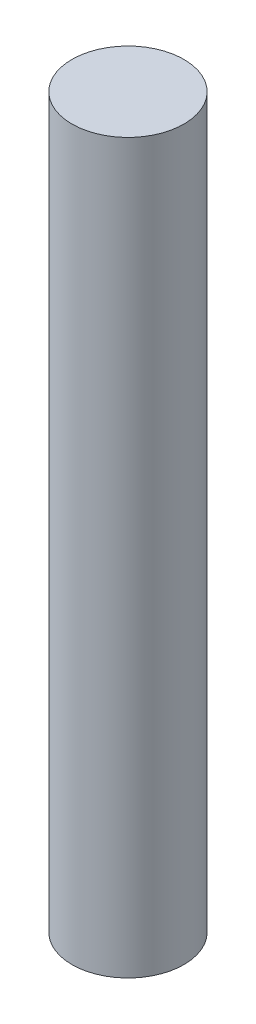
from build123d import *

# Parameters (mm, degrees)
SKETCH1_R           = 5
BOSS_EXTRUDE1_DEPTH = 32.5


with BuildPart() as part:
    # Sketch1 → Boss-Extrude1 (new, symmetric)
    with BuildSketch(Plane(origin=(0, 0, 0), x_dir=(1, 0, 0), z_dir=(0, 1, 0))):
        with Locations(Location((0, 0, 0), (0, 0, 270))):
            Circle(SKETCH1_R)
    extrude(amount=BOSS_EXTRUDE1_DEPTH, both=True)


solid = part.part
